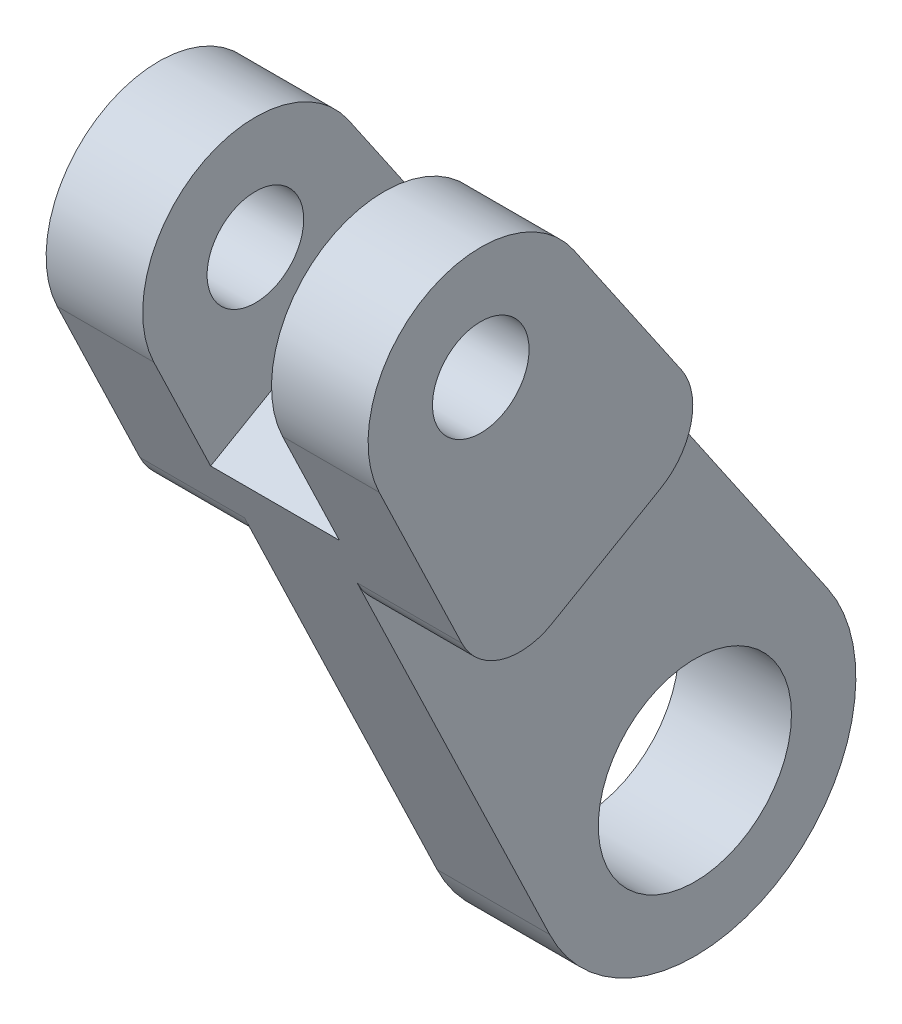
from build123d import *

# Parameters (mm, degrees)
BOSS_EXTRUDE1_DEPTH      = 1.75
BOSS_EXTRUDE1_DEPTH_BACK = 1.75
SKETCH1_R                = 5
SKETCH1_R_2              = 3
BOSS_EXTRUDE4_DEPTH      = 2
BOSS_EXTRUDE4_DEPTH_BACK = 2
BOSS_EXTRUDE2_START      = 2
SKETCH1_3_R              = 3.4999999999999996
SKETCH1_3_R_2            = 1.5000000000000024
BOSS_EXTRUDE2_DEPTH      = 3
BOSS_EXTRUDE3_START      = -5
SKETCH1_4_R              = 3.4999999999999996
SKETCH1_4_R_2            = 1.5000000000000024
BOSS_EXTRUDE3_DEPTH      = 3
FILLET2_R                = 2


with BuildPart() as part:
    # Sketch1 → Boss-Extrude1 (new, two sides: drawn at the far end of the back side and taken through both)
    # profile 1 of 3: a face of its own
    with BuildSketch(Plane(origin=(0, 0, 0), x_dir=(0, 0, -1), z_dir=(1, 0, 0)).offset(-BOSS_EXTRUDE1_DEPTH_BACK)):
        with BuildLine():
            Line((4.128289444917901, 2.820855589883948), (-2.446958304851689, 12.443654424549113))
            Line((-2.4469583048516905, 12.443654424549113), (-9.553041695148336, 8.340955266277398))
            Line((-9.553041695148337, 8.340955266277398), (-4.507077323705776, -2.1647757385320965))
            ThreePointArc((-4.507077323705776, -2.1647757385320965), (-2.500000000000005, 4.33012701892219), (4.128289444917895, 2.8208555898839442))
        make_face()
    # profile 2 of 3: a face of its own
    with BuildSketch(Plane(origin=(0, 0, 0), x_dir=(0, 0, -1), z_dir=(1, 0, 0)).offset(-BOSS_EXTRUDE1_DEPTH_BACK)):
        Circle(SKETCH1_R)
        Circle(SKETCH1_R_2, mode=Mode.SUBTRACT)
    # profile 3 of 3: a face of its own
    with BuildSketch(Plane(origin=(0, 0, 0), x_dir=(0, 0, -1), z_dir=(1, 0, 0)).offset(-BOSS_EXTRUDE1_DEPTH_BACK)):
        Polygon((-2.446958304851689, 12.443654424549113), (-4.710146578566388, 15.755804219010134), (-11.289853421433653, 11.957008702091882), (-9.553041695148337, 8.340955266277398), align=None)
    extrude(amount=BOSS_EXTRUDE1_DEPTH + BOSS_EXTRUDE1_DEPTH_BACK)

    # Sketch1<5> → Boss-Extrude4 (add, two sides: drawn at the far end of the back side and taken through both)
    with BuildSketch(Plane(origin=(0, 0, 0), x_dir=(0, 0, -1), z_dir=(1, 0, 0)).offset(-BOSS_EXTRUDE4_DEPTH_BACK)):
        Polygon((-2.446958304851689, 12.443654424549113), (-4.710146578566388, 15.755804219010134), (-11.289853421433653, 11.957008702091882), (-9.553041695148337, 8.340955266277398), align=None)
    extrude(amount=BOSS_EXTRUDE4_DEPTH + BOSS_EXTRUDE4_DEPTH_BACK)

    # Sketch1<3> → Boss-Extrude2 (add)
    # profile 1 of 3: a face of its own
    with BuildSketch(Plane(origin=(0, 0, 0), x_dir=(0, 0, -1), z_dir=(1, 0, 0)).offset(BOSS_EXTRUDE2_START)):
        Polygon((-2.446958304851689, 12.443654424549113), (-4.710146578566388, 15.755804219010134), (-11.289853421433653, 11.957008702091882), (-9.553041695148337, 8.340955266277398), align=None)
    # profile 2 of 3: a face of its own
    with BuildSketch(Plane(origin=(0, 0, 0), x_dir=(0, 0, -1), z_dir=(1, 0, 0)).offset(BOSS_EXTRUDE2_START)):
        with BuildLine():
            Line((-4.710146578566388, 15.755804219010134), (-7.0101973885575, 19.12190190785064))
            ThreePointArc((-7.010197388557501, 19.12190190785064), (-6.556027127797799, 18.18066906268114), (-6.400000000000027, 17.147302994931877))
            ThreePointArc((-6.400000000000027, 17.147302994931877), (-9.122934829978606, 13.734654504164101), (-13.054954126594069, 15.63195997795941))
            Line((-13.054954126594073, 15.631959977959408), (-11.289853421433653, 11.957008702091882))
            Line((-11.289853421433653, 11.957008702091882), (-4.7101465785663885, 15.755804219010134))
        make_face()
    # profile 3 of 3: a face of its own
    with BuildSketch(Plane(origin=(0, 0, 0), x_dir=(0, 0, -1), z_dir=(1, 0, 0)).offset(BOSS_EXTRUDE2_START)):
        with Locations((-9.900000000000027, 17.147302994931877)):
            Circle(SKETCH1_3_R)
        with Locations((-9.900000000000027, 17.147302994931877)):
            Circle(SKETCH1_3_R_2, mode=Mode.SUBTRACT)
    extrude(amount=BOSS_EXTRUDE2_DEPTH)

    # Sketch1<4> → Boss-Extrude3 (add)
    # profile 1 of 3: a face of its own
    with BuildSketch(Plane(origin=(0, 0, 0), x_dir=(0, 0, -1), z_dir=(1, 0, 0)).offset(BOSS_EXTRUDE3_START)):
        with BuildLine():
            Line((-4.710146578566388, 15.755804219010134), (-7.0101973885575, 19.12190190785064))
            ThreePointArc((-7.010197388557501, 19.12190190785064), (-6.556027127797799, 18.18066906268114), (-6.400000000000027, 17.147302994931877))
            ThreePointArc((-6.400000000000027, 17.147302994931877), (-9.122934829978606, 13.734654504164101), (-13.054954126594069, 15.63195997795941))
            Line((-13.054954126594073, 15.631959977959408), (-11.289853421433653, 11.957008702091882))
            Line((-11.289853421433653, 11.957008702091882), (-4.7101465785663885, 15.755804219010134))
        make_face()
    # profile 2 of 3: a face of its own
    with BuildSketch(Plane(origin=(0, 0, 0), x_dir=(0, 0, -1), z_dir=(1, 0, 0)).offset(BOSS_EXTRUDE3_START)):
        Polygon((-2.446958304851689, 12.443654424549113), (-4.710146578566388, 15.755804219010134), (-11.289853421433653, 11.957008702091882), (-9.553041695148337, 8.340955266277398), align=None)
    # profile 3 of 3: a face of its own
    with BuildSketch(Plane(origin=(0, 0, 0), x_dir=(0, 0, -1), z_dir=(1, 0, 0)).offset(BOSS_EXTRUDE3_START)):
        with Locations((-9.900000000000027, 17.147302994931877)):
            Circle(SKETCH1_4_R)
        with Locations((-9.900000000000027, 17.147302994931877)):
            Circle(SKETCH1_4_R_2, mode=Mode.SUBTRACT)
    extrude(amount=BOSS_EXTRUDE3_DEPTH)

    # Fillet2
    fillet2_edges = [part.edges().sort_by_distance(p)[0] for p in [
        (-3.375, 12.443654424549113, 2.4469583048516905),
        (-3.375, 8.340955266277398, 9.553041695148337),
        (3.375, 12.443654424549113, 2.44695830485169),
        (3.375, 8.340955266277398, 9.553041695148337),
    ]]
    fillet(fillet2_edges, radius=FILLET2_R)


solid = part.part
